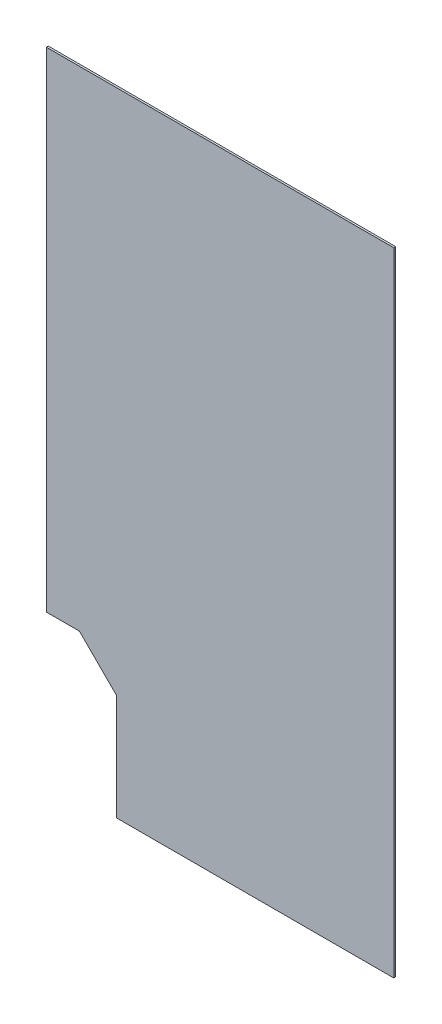
from build123d import *

# Parameters (mm, degrees)
BOSS_EXTRUDE2_DEPTH = 8


with BuildPart() as part:
    # Sketch2 → Boss-Extrude2 (new body)
    with BuildSketch(Plane.XY):
        Polygon((-473.811188811, 1472.769230769), (941.188811189, 1472.769230769), (941.188811189, -1102.230769231), (-188.811188811, -1102.230769231), (-188.811188811, -669.230769231), (-338.811188811, -519.230769231), (-473.811188811, -519.230769231), align=None)
    extrude(amount=BOSS_EXTRUDE2_DEPTH)


solid = part.part
